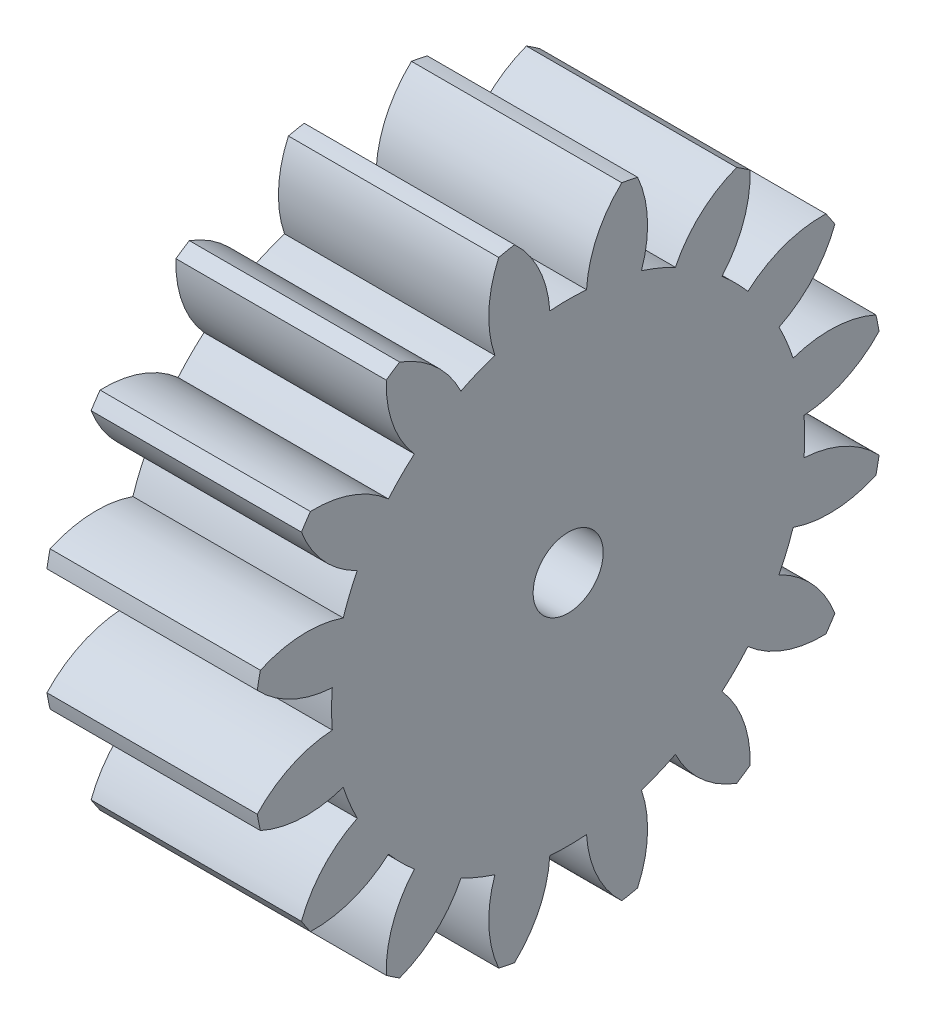
from build123d import *

# Parameters (mm, degrees)
BASPROSKE_W     = 6
BASPROSKE_H     = 9
TOOTHCUT_DEPTH  = 15.071247279
TEETHCUTS_COUNT = 16
TEETHCUTS_ANGLE = 337.5
BORSKE_R        = 1
BORE_DEPTH      = 50.0000508


with BuildPart() as part:
    # BasProSke → Base-Revolve (revolve)
    with BuildSketch(Plane(origin=(0, 0, 0), x_dir=(1, 0, 0), z_dir=(0, 1, 0)), mode=Mode.PRIVATE) as base_revolve_sk:
        with Locations((3, 4.5)):
            Rectangle(BASPROSKE_W, BASPROSKE_H)
    revolve(base_revolve_sk.sketch.rotate(Axis((-10, 0, 0), (1, 0, 0)), 180), axis=Axis((-10, 0, 0), (1, 0, 0)))

    # TooCutSke → ToothCut (cut, through all)
    with BuildSketch(Plane(origin=(0, 0, 0), x_dir=(0, 0, -1), z_dir=(1, 0, 0))):
        with BuildLine():
            ThreePointArc((0.523792937, 6.728643397), (0, 6.749), (-0.523792937, 6.728643397))
            ThreePointArc((-0.523792937, 6.728643397), (-0.828704482, 7.90962059), (-1.553355277, 8.890721711))
            ThreePointArc((-1.553355277, 8.890721711), (0, 9.0254), (1.553355277, 8.890721711))
            ThreePointArc((1.553355277, 8.890721711), (0.828704482, 7.90962059), (0.523792937, 6.728643397))
        make_face()
    toothcut = extrude(amount=TOOTHCUT_DEPTH, mode=Mode.SUBTRACT)

    # TeethCuts: ToothCut ×16 about axis
    teethcuts_axis = Axis((-10, 0, 0), (1, 0, 0))
    for i in range(1, TEETHCUTS_COUNT):
        add(toothcut.rotate(teethcuts_axis, i * TEETHCUTS_ANGLE / (TEETHCUTS_COUNT - 1)), mode=Mode.SUBTRACT)

    # BorSke → Bore (cut, symmetric)
    with BuildSketch(Plane(origin=(0, 0, 0), x_dir=(0, 0, -1), z_dir=(1, 0, 0))):
        with Locations(Location((0, 0, 0), (0, 0, 180))):
            Circle(BORSKE_R)
    extrude(amount=BORE_DEPTH, both=True, mode=Mode.SUBTRACT)


solid = part.part
